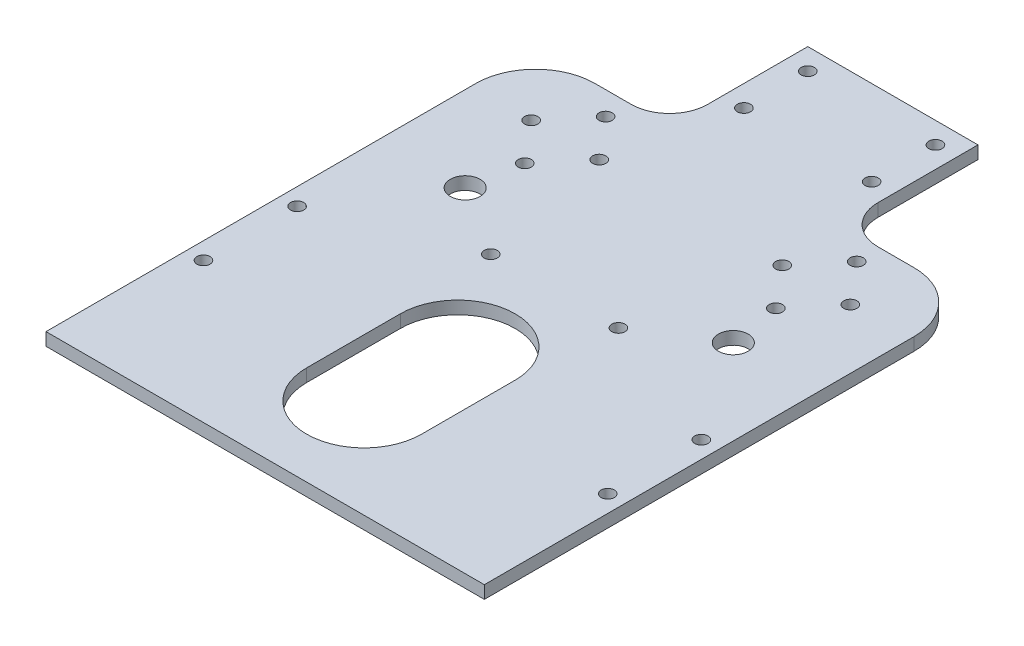
from build123d import *

# Parameters (mm, degrees)
SKETCH_1_W              = 200
SKETCH_1_H              = 200
EXTRUDE_1_DEPTH         = 3
SKETCH_2_R              = 1.55
CUT_EXTRUDE_2_DEPTH     = 10
CUT_EXTRUDE_3_DEPTH     = 10
SKETCH_6_R              = 1.55
CUT_EXTRUDE_3_1_1_DEPTH = 10
SKETCH_7_R              = 1.55
CUT_EXTRUDE_3_1_2_DEPTH = 113.522220028
CUT_EXTRUDE_21_DEPTH    = 10
CUT_EXTRUDE_6_REACH     = 114.522
SKETCH_10_R             = 3.5


with BuildPart() as part:
    # 草图1 → 凸台-拉伸1 (new body)
    with BuildSketch(Plane(origin=(0, 0, 0), x_dir=(1, 0, 0), z_dir=(0, 1, 0))):
        Rectangle(SKETCH_1_W, SKETCH_1_H)
    extrude(amount=EXTRUDE_1_DEPTH)

    # 草图2 → 切除-拉伸2 (cut)
    with BuildSketch(Plane(origin=(0, 3, 0), x_dir=(1, 0, 0), z_dir=(0, 1, 0))):
        with Locations(Location((29.5, 9.5, 0), (0, 0, 270))):
            Circle(SKETCH_2_R)
        with Locations(Location((21.5, 0, 0), (0, 0, 270))):
            Circle(SKETCH_2_R)
        with Locations(Location((29.5, -9.5, 0), (0, 0, 270))):
            Circle(SKETCH_2_R)
        with Locations(Location((37.5, 0, 0), (0, 0, 270))):
            Circle(SKETCH_2_R)
        with Locations(Location((-29.5, -9.5, 0), (0, 0, 270))):
            Circle(SKETCH_2_R)
        with Locations(Location((-37.5, 0, 0), (0, 0, 270))):
            Circle(SKETCH_2_R)
        with Locations(Location((-21.5, 0, 0), (0, 0, 270))):
            Circle(SKETCH_2_R)
        with Locations(Location((-29.5, 9.5, 0), (0, 0, 270))):
            Circle(SKETCH_2_R)
        with Locations(Location((-15, -32, 0), (0, 0, 270))):
            Circle(SKETCH_2_R)
        with Locations(Location((15, -32, 0), (0, 0, 270))):
            Circle(SKETCH_2_R)
    extrude(amount=-CUT_EXTRUDE_2_DEPTH, mode=Mode.SUBTRACT)

    # 草图5 → 切除-拉伸3 (cut)
    with BuildSketch(Plane(origin=(0, 3, 0), x_dir=(1, 0, 0), z_dir=(0, 1, 0))):
        with BuildLine():
            Line((-51.5, -100), (-51.5, 0))
            Line((-51.5, 0), (-51.5, 0.9969997))
            ThreePointArc((-51.5, 0.9969997), (-47.399494937, 10.896494637), (-37.5, 14.9969997))
            Line((-37.5, 14.9969997), (-29, 14.9969997))
            ThreePointArc((-29, 14.9969997), (-22.636038969, 17.633038669), (-20, 23.9969997))
            Line((-20, 23.9969997), (-20, 24.9949995))
            Line((-20, 24.9949995), (-20, 47.5))
            Line((-20, 47.5), (0, 47.5))
            Line((0, 47.5), (20, 47.5))
            Line((20, 47.5), (20, 24.9949995))
            Line((20, 24.9949995), (20, 23.9969997))
            ThreePointArc((20, 23.9969997), (22.636038969, 17.633038669), (29, 14.9969997))
            Line((29, 14.9969997), (37.5, 14.9969997))
            ThreePointArc((37.5, 14.9969997), (47.399494937, 10.896494637), (51.5, 0.9969997))
            Line((51.5, 0.9969997), (51.5, 0))
            Line((51.5, 0), (51.5, -100))
            Line((51.5, -100), (100, -100))
            Line((100, -100), (100, 100))
            Line((100, 100), (-100, 100))
            Line((-100, 100), (-100, -100))
            Line((-100, -100), (-51.5, -100))
        make_face()
    extrude(amount=-CUT_EXTRUDE_3_DEPTH, mode=Mode.SUBTRACT)

    # 草图6 → φ3.1通孔1 (cut)
    with BuildSketch(Plane.XZ):
        with Locations(Location((-15, -42.5, 0), (0, 0, 270))):
            Circle(SKETCH_6_R)
        with Locations(Location((-15, -27.5, 0), (0, 0, 270))):
            Circle(SKETCH_6_R)
        with Locations(Location((15, -27.5, 0), (0, 0, 90))):
            Circle(SKETCH_6_R)
        with Locations(Location((15, -42.5, 0), (0, 0, 90))):
            Circle(SKETCH_6_R)
    extrude(amount=-CUT_EXTRUDE_3_1_1_DEPTH, mode=Mode.SUBTRACT)

    # 草图7 → φ3.1通孔2 (cut, through all)
    with BuildSketch(Plane(origin=(0, 3, 0), x_dir=(1, 0, 0), z_dir=(0, 1, 0))):
        with Locations(Location((-47.5, -45, 0), (0, 0, 270))):
            Circle(SKETCH_7_R)
        with Locations(Location((-47.5, -67, 0), (0, 0, 270))):
            Circle(SKETCH_7_R)
        with Locations(Location((47.5, -45, 0), (0, 0, 270))):
            Circle(SKETCH_7_R)
        with Locations(Location((47.5, -67, 0), (0, 0, 270))):
            Circle(SKETCH_7_R)
    extrude(amount=-CUT_EXTRUDE_3_1_2_DEPTH, mode=Mode.SUBTRACT)

    # 草图9 → φ21拨单电机孔 (cut)
    with BuildSketch(Plane(origin=(0, 3, 0), x_dir=(1, 0, 0), z_dir=(0, 1, 0))):
        with BuildLine():
            Line((-13.5, -54.75), (-13.5, -76.75))
            ThreePointArc((-13.5, -76.75), (0, -90.25), (13.5, -76.75))
            Line((13.5, -76.75), (13.5, -54.75))
            ThreePointArc((13.5, -54.75), (0, -41.25), (-13.5, -54.75))
        make_face()
    extrude(amount=-CUT_EXTRUDE_21_DEPTH, mode=Mode.SUBTRACT)

    # 草图10 → 切除-拉伸6 (cut, up to next)
    with BuildSketch(Plane.XZ, mode=Mode.PRIVATE) as cut_extrude_6_sk1:
        with Locations(Location((-31.5, 21.5, 0), (0, 0, 270))):
            Circle(SKETCH_10_R)
    cut_extrude_6_tool1 = extrude(cut_extrude_6_sk1.sketch, amount=-CUT_EXTRUDE_6_REACH, mode=Mode.PRIVATE) & part.part
    # 草图10 → 切除-拉伸6 (cut, up to next)
    with BuildSketch(Plane.XZ, mode=Mode.PRIVATE) as cut_extrude_6_sk2:
        with Locations(Location((31.5, 21.5, 0), (0, 0, 270))):
            Circle(SKETCH_10_R)
    cut_extrude_6_tool2 = extrude(cut_extrude_6_sk2.sketch, amount=-CUT_EXTRUDE_6_REACH, mode=Mode.PRIVATE) & part.part
    add(cut_extrude_6_tool1.solids().sort_by_distance((-31.5, 0, 21.5))[0], mode=Mode.SUBTRACT)
    add(cut_extrude_6_tool2.solids().sort_by_distance((31.5, 0, 21.5))[0], mode=Mode.SUBTRACT)


solid = part.part
